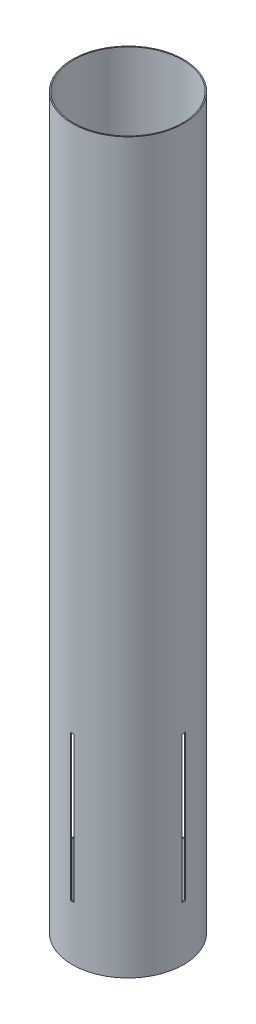
from build123d import *

# Parameters (mm, degrees)
SKETCH1_R           = 77.6224
SKETCH1_R_2         = 76.2
BOSS_EXTRUDE1_DEPTH = 508
SKETCH3_W           = 4.7498
SKETCH3_H           = 203.2
CUT_EXTRUDE1_DEPTH  = 520.72538322
CIRPATTERN2_COUNT   = 4


with BuildPart() as part:
    # Sketch1 → Boss-Extrude1 (new, symmetric)
    with BuildSketch(Plane(origin=(0, 0, 0), x_dir=(1, 0, 0), z_dir=(0, 1, 0))):
        with Locations(Location((0, 0, 0), (0, 0, 270))):
            Circle(SKETCH1_R)
        with Locations(Location((0, 0, 0), (0, 0, 270))):
            Circle(SKETCH1_R_2, mode=Mode.SUBTRACT)
    extrude(amount=BOSS_EXTRUDE1_DEPTH, both=True)

    # Sketch3 → Cut-Extrude1 (cut, through all)
    with BuildSketch(Plane.XY):
        with Locations((0, -330.2)):
            Rectangle(SKETCH3_W, SKETCH3_H)
    cut_extrude1 = extrude(amount=-CUT_EXTRUDE1_DEPTH, mode=Mode.SUBTRACT)

    # CirPattern2: Cut-Extrude1 ×4 about axis
    cirpattern2_axis = Axis((0, 0, 0), (0, 1, 0))
    for i in range(1, CIRPATTERN2_COUNT):
        add(cut_extrude1.rotate(cirpattern2_axis, i * 360 / CIRPATTERN2_COUNT), mode=Mode.SUBTRACT)


solid = part.part
